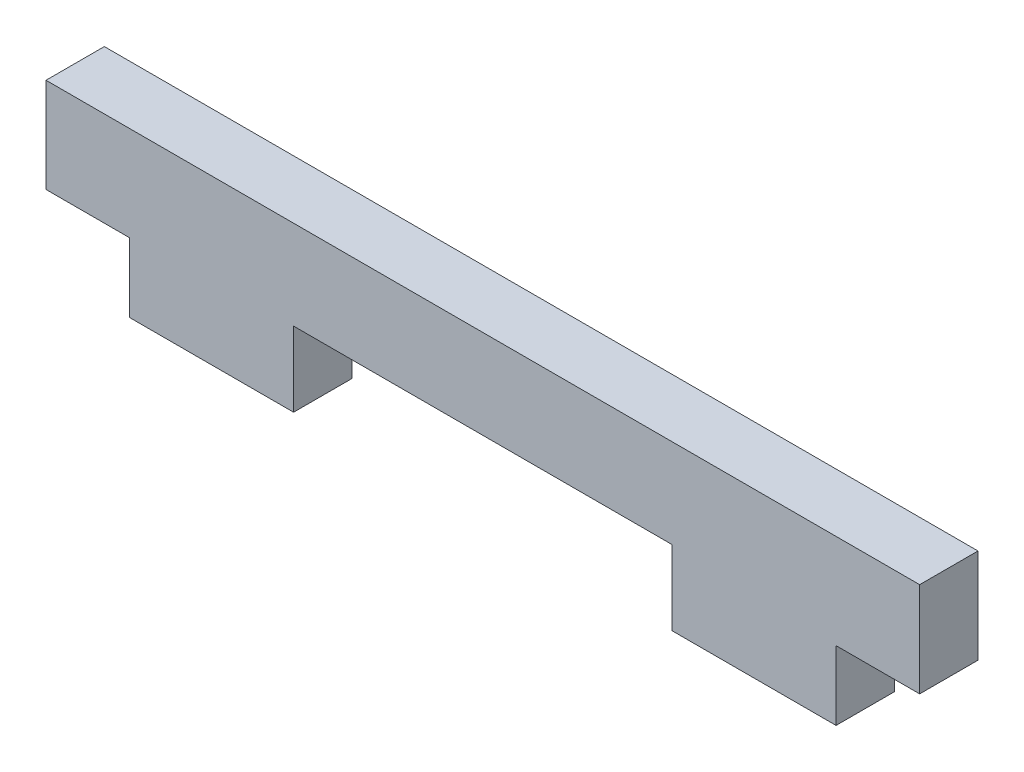
from build123d import *

# Parameters (mm, degrees)
BOSS_EXTRUDE1_DEPTH = 3.7


with BuildPart() as part:
    # Sketch1 → Boss-Extrude1 (new body)
    with BuildSketch(Plane.XY):
        Polygon((-21.693712593, 0), (33.706287407, 0), (33.706287407, -6), (28.406287407, -6), (28.406287407, -10.381805668), (18.006287407, -10.381805668), (18.006287407, -5.65013307), (-5.993712593, -5.65013307), (-5.993712593, -10.381805668), (-16.393712593, -10.381805668), (-16.393712593, -6), (-21.693712593, -6), align=None)
    extrude(amount=BOSS_EXTRUDE1_DEPTH)


solid = part.part
